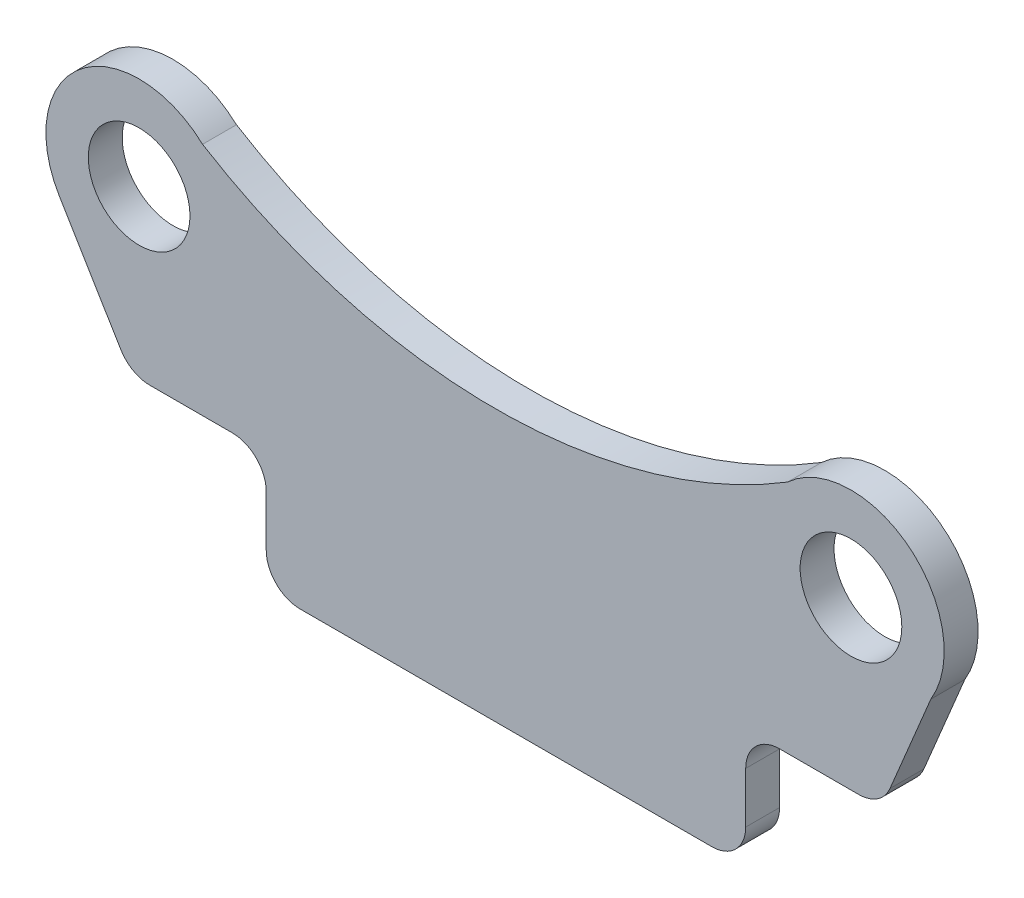
from build123d import *

# Parameters (mm, degrees)
IZIM1_R                     = 30
Y_KSEKLIK_EKSTR_ZYON1_DEPTH = 20


with BuildPart() as part:
    # Çizim1 → Yükseklik-Ekstrüzyon1 (new body)
    with BuildSketch(Plane.XY):
        with BuildLine():
            Line((-47.124957284, -28.359097323), (-10.82985396, -88.671496349))
            ThreePointArc((-10.82985396, -88.671496349), (-3.536066994, -95.769553672), (6.306494143, -98.359097323))
            Line((6.306494143, -98.359097323), (55, -98.359097323))
            ThreePointArc((55, -98.359097323), (69.142135624, -104.216961699), (75, -118.359097323))
            Line((75, -118.359097323), (75, -148.359097323))
            ThreePointArc((75, -148.359097323), (80.857864376, -162.501232947), (95, -168.359097323))
            Line((95, -168.359097323), (337.882293863, -168.359097323))
            ThreePointArc((337.882293863, -168.359097323), (352.024429487, -162.501232947), (357.882293863, -148.359097323))
            Line((357.882293863, -148.359097323), (357.882293863, -118.359097323))
            ThreePointArc((357.882293863, -118.359097323), (363.740158239, -104.216961699), (377.882293863, -98.359097323))
            Line((377.882293863, -98.359097323), (424.56231333, -98.359097323))
            ThreePointArc((424.56231333, -98.359097323), (435.648622021, -95.005230796), (443.016730749, -86.068473283))
            Line((443.016730749, -86.068473283), (467.124957284, -28.359097323))
            ThreePointArc((467.124957284, -28.359097323), (454.66761994, 42.69843238), (382.566415624, 40.295493058))
            ThreePointArc((382.566415624, 40.295493058), (210, -8.444596477), (37.433584376, 40.295493058))
            ThreePointArc((37.433584376, 40.295493058), (-34.66761994, 42.69843238), (-47.124957284, -28.359097323))
        make_face()
        Circle(IZIM1_R, mode=Mode.SUBTRACT)
        with Locations((420, 0)):
            Circle(IZIM1_R, mode=Mode.SUBTRACT)
    extrude(amount=Y_KSEKLIK_EKSTR_ZYON1_DEPTH)


solid = part.part
